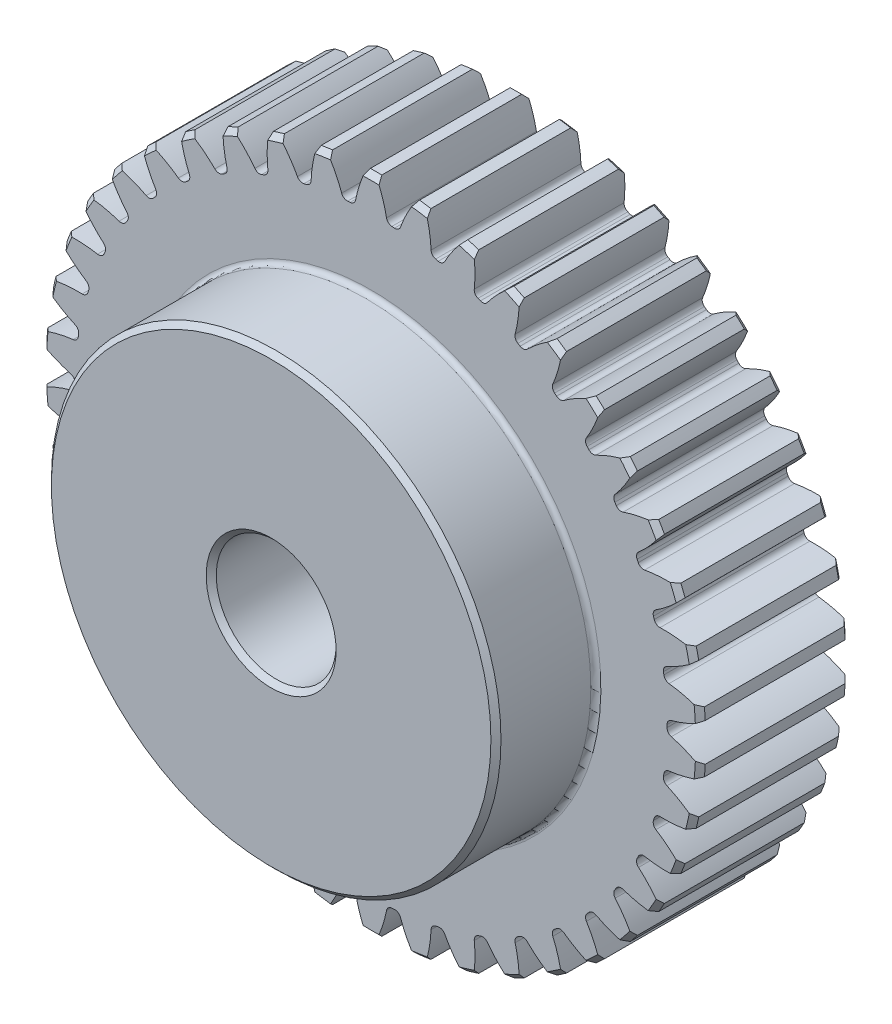
from build123d import *

# Parameters (mm, degrees)
BOSS_EXTRUDE1_DEPTH      = 10
BOSS_EXTRUDE1_DEPTH_BACK = 15
SKETCH3_R                = 33
SKETCH5_W                = 10
SKETCH5_H                = 10.5
SKETCH5_W_2              = 25
SKETCH5_H_2              = 6
FILLET2_R                = 0.503257554
CHAMFER1_SIZE            = 0.503257554
CUT_EXTRUDE1_DEPTH       = 50.020403915
FILLET1_R                = 0.589048623
CIRPATTERN1_COUNT        = 42
FILLET1_OF_CIRPATTERN1_R = 0.589048623


with BuildPart() as part:
    # Sketch3 → Boss-Extrude1 (new, two sides: drawn at the far end of the back side and taken through both)
    with BuildSketch(Plane.XY.offset(-BOSS_EXTRUDE1_DEPTH_BACK)):
        Circle(SKETCH3_R)
    extrude(amount=BOSS_EXTRUDE1_DEPTH + BOSS_EXTRUDE1_DEPTH_BACK)

    # Sketch5 → Cut-Revolve1 (revolve, cut)
    with BuildSketch(Plane(origin=(0, 0, 0), x_dir=(0, 0, -1), z_dir=(1, 0, 0)), mode=Mode.PRIVATE) as cut_revolve1_sk:
        with Locations((-5, 27.75)):
            Rectangle(SKETCH5_W, SKETCH5_H)
        with Locations((2.5, 3)):
            Rectangle(SKETCH5_W_2, SKETCH5_H_2)
    revolve(cut_revolve1_sk.sketch.rotate(Axis((0, 0, 10), (0, 0, -1)), 180), axis=Axis((0, 0, 10), (0, 0, -1)), mode=Mode.SUBTRACT)

    # Fillet2
    fillet2_edges = [part.edges().sort_by_distance(p)[0] for p in [
        (0, 22.5, 0),
    ]]
    fillet(fillet2_edges, radius=FILLET2_R)

    # Chamfer1
    chamfer1_edges = [part.edges().sort_by_distance(p)[0] for p in [
        (0, 6, 10),
        (0, 6, -15),
        (-33, 0, 0),
        (0, 22.5, 10),
        (-33, 0, -15),
    ]]
    chamfer(chamfer1_edges, length=CHAMFER1_SIZE)

    # Sketch4 → Cut-Extrude1 (cut, symmetric)
    with BuildSketch(Plane.XY):
        with BuildLine():
            Line((29.619143248, 0.589048623), (29.619143248, -0.589048623))
            ThreePointArc((29.619143248, -0.589048623), (31.328590365, -1.123847712), (32.945588049, -1.894261891))
            ThreePointArc((32.945588049, -1.894261891), (33, 0), (32.945588049, 1.894261891))
            ThreePointArc((32.945588049, 1.894261891), (31.328590365, 1.123847712), (29.619143248, 0.589048623))
        make_face()
    cut_extrude1 = extrude(amount=CUT_EXTRUDE1_DEPTH, both=True, mode=Mode.SUBTRACT)

    # Fillet1
    fillet1_edges = [part.edges().sort_by_distance(p)[0] for p in [
        (29.619143248, 0.589048623, -7.5),
        (29.619143248, -0.589048623, -7.5),
    ]]
    fillet(fillet1_edges, radius=FILLET1_R)

    # CirPattern1: Cut-Extrude1 ×42 about axis
    cirpattern1_axis = Axis((0, 0, 0), (0, 0, 1))
    for i in range(1, CIRPATTERN1_COUNT):
        add(cut_extrude1.rotate(cirpattern1_axis, i * 360 / CIRPATTERN1_COUNT), mode=Mode.SUBTRACT)

    # Fillet1 of CirPattern1
    fillet1_of_cirpattern1_edges = [part.edges().sort_by_distance(p)[0] for p in [
        (29.200528748, 4.996973668, -7.5),
        (29.376115031, 3.832034796, -7.5),
        (28.129622689, 9.293274579, -7.5),
        (28.476872948, 8.167516889, -7.5),
        (26.430347341, 13.381979092, -7.5),
        (26.941504579, 12.320550151, -7.5),
        (24.140661709, 17.171752306, -7.5),
        (24.804307517, 16.198362682, -7.5),
        (21.311713585, 20.577936948, -7.5),
        (22.113023214, 19.714330558, -7.5),
        (18.006696997, 23.524444484, -7.5),
        (18.927770512, 22.789912866, -7.5),
        (14.299440553, 25.945454802, -7.5),
        (15.319702695, 25.356406179, -7.5),
        (10.272758236, 27.786886534, -7.5),
        (11.369418034, 27.356479279, -7.5),
        (6.016599475, 29.007605137, -7.5),
        (7.165159362, 28.745453837, -7.5),
        (1.626039824, 29.580341774, -7.5),
        (2.80084287, 29.492302457, -7.5),
        (-2.80084287, 29.492302457, -7.5),
        (-1.626039824, 29.580341774, -7.5),
        (-7.165159362, 28.745453837, -7.5),
        (-6.016599475, 29.007605137, -7.5),
        (-11.369418034, 27.356479279, -7.5),
        (-10.272758236, 27.786886534, -7.5),
        (-15.319702695, 25.356406179, -7.5),
        (-14.299440553, 25.945454802, -7.5),
        (-18.927770512, 22.789912866, -7.5),
        (-18.006696997, 23.524444484, -7.5),
        (-22.113023214, 19.714330558, -7.5),
        (-21.311713585, 20.577936948, -7.5),
        (-24.804307517, 16.198362682, -7.5),
        (-24.140661709, 17.171752306, -7.5),
        (-26.941504579, 12.320550151, -7.5),
        (-26.430347341, 13.381979092, -7.5),
        (-28.476872948, 8.167516889, -7.5),
        (-28.129622689, 9.293274579, -7.5),
        (-29.376115031, 3.832034796, -7.5),
        (-29.200528748, 4.996973668, -7.5),
        (-29.619143248, -0.589048623, -7.5),
        (-29.619143248, 0.589048623, -7.5),
        (-29.200528748, -4.996973668, -7.5),
        (-29.376115031, -3.832034796, -7.5),
        (-28.129622689, -9.293274579, -7.5),
        (-28.476872948, -8.167516889, -7.5),
        (-26.430347341, -13.381979092, -7.5),
        (-26.941504579, -12.320550151, -7.5),
        (-24.140661709, -17.171752306, -7.5),
        (-24.804307517, -16.198362682, -7.5),
        (-21.311713585, -20.577936948, -7.5),
        (-22.113023214, -19.714330558, -7.5),
        (-18.006696997, -23.524444484, -7.5),
        (-18.927770512, -22.789912866, -7.5),
        (-14.299440553, -25.945454802, -7.5),
        (-15.319702695, -25.356406179, -7.5),
        (-10.272758236, -27.786886534, -7.5),
        (-11.369418034, -27.356479279, -7.5),
        (-6.016599475, -29.007605137, -7.5),
        (-7.165159362, -28.745453837, -7.5),
        (-1.626039824, -29.580341774, -7.5),
        (-2.80084287, -29.492302457, -7.5),
        (2.80084287, -29.492302457, -7.5),
        (1.626039824, -29.580341774, -7.5),
        (7.165159362, -28.745453837, -7.5),
        (6.016599475, -29.007605137, -7.5),
        (11.369418034, -27.356479279, -7.5),
        (10.272758236, -27.786886534, -7.5),
        (15.319702695, -25.356406179, -7.5),
        (14.299440553, -25.945454802, -7.5),
        (18.927770512, -22.789912866, -7.5),
        (18.006696997, -23.524444484, -7.5),
        (22.113023214, -19.714330558, -7.5),
        (21.311713585, -20.577936948, -7.5),
        (24.804307517, -16.198362682, -7.5),
        (24.140661709, -17.171752306, -7.5),
        (26.941504579, -12.320550151, -7.5),
        (26.430347341, -13.381979092, -7.5),
        (28.476872948, -8.167516889, -7.5),
        (28.129622689, -9.293274579, -7.5),
        (29.376115031, -3.832034796, -7.5),
        (29.200528748, -4.996973668, -7.5),
    ]]
    fillet(fillet1_of_cirpattern1_edges, radius=FILLET1_OF_CIRPATTERN1_R)


solid = part.part
